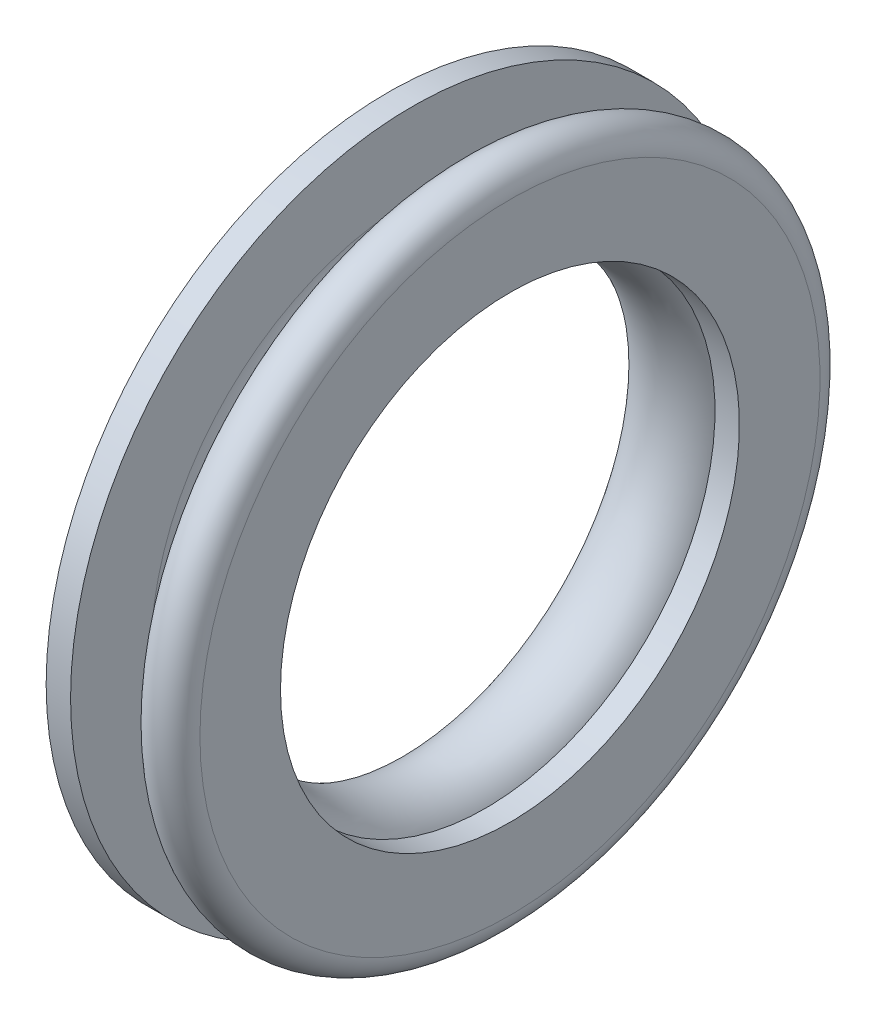
from build123d import *


with BuildPart() as part:
    # Çizim1 → Döndür1 (revolve)
    with BuildSketch(Plane.XY, mode=Mode.PRIVATE) as d_nd_r1_sk:
        with BuildLine():
            Line((0, 7), (0, 5.35))
            ThreePointArc((0, 5.35), (1, 4.35), (2, 5.35))
            Line((2, 5.35), (2, 4.7))
            Line((2, 4.7), (2.5, 4.7))
            Line((2.5, 4.7), (2.5, 6.35))
            ThreePointArc((2.5, 6.35), (2, 6.85), (1.5, 6.35))
            Line((1.5, 6.35), (1.5, 5.35))
            ThreePointArc((1.5, 5.35), (1, 4.85), (0.5, 5.35))
            Line((0.5, 5.35), (0.5, 7))
            Line((0.5, 7), (0, 7))
        make_face()
    revolve(d_nd_r1_sk.sketch.rotate(Axis((0, 0, 0), (1, 0, 0)), 90), axis=Axis((0, 0, 0), (1, 0, 0)))


solid = part.part
